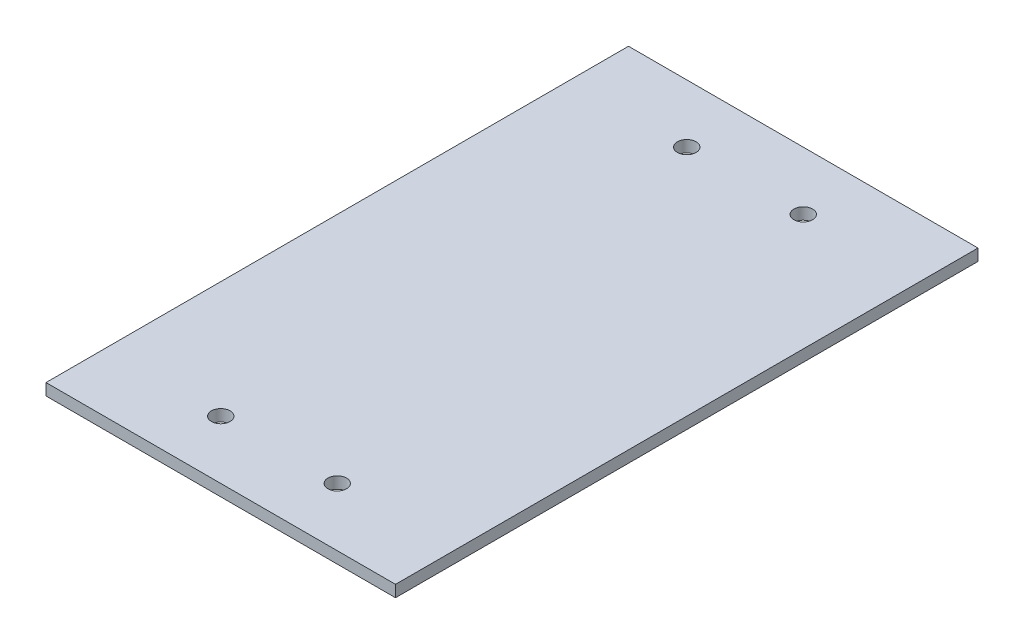
from build123d import *

# Parameters (mm, degrees)
SKETCH_1_W          = 60
SKETCH_1_H          = 100
EXTRUDE_1_DEPTH     = 2
CUT_EXTRUDE_1_REACH = 60.344
SKETCH_2_R          = 1.6


with BuildPart() as part:
    # 草图1 → 凸台-拉伸1 (new body)
    with BuildSketch(Plane(origin=(0, 0, 0), x_dir=(1, 0, 0), z_dir=(0, 1, 0))):
        Rectangle(SKETCH_1_W, SKETCH_1_H)
    extrude(amount=EXTRUDE_1_DEPTH)

    # 草图2 → 切除-拉伸1 (cut, up to next)
    with BuildSketch(Plane(origin=(0, 2, 0), x_dir=(1, 0, 0), z_dir=(0, 1, 0)), mode=Mode.PRIVATE) as cut_extrude_1_sk1:
        with Locations(Location((-10, 40, 0), (0, 0, 270))):
            Circle(SKETCH_2_R)
    cut_extrude_1_tool1 = extrude(cut_extrude_1_sk1.sketch, amount=-CUT_EXTRUDE_1_REACH, mode=Mode.PRIVATE) & part.part
    # 草图2 → 切除-拉伸1 (cut, up to next)
    with BuildSketch(Plane(origin=(0, 2, 0), x_dir=(1, 0, 0), z_dir=(0, 1, 0)), mode=Mode.PRIVATE) as cut_extrude_1_sk2:
        with Locations(Location((-10, -40, 0), (0, 0, 90))):
            Circle(SKETCH_2_R)
    cut_extrude_1_tool2 = extrude(cut_extrude_1_sk2.sketch, amount=-CUT_EXTRUDE_1_REACH, mode=Mode.PRIVATE) & part.part
    # 草图2 → 切除-拉伸1 (cut, up to next)
    with BuildSketch(Plane(origin=(0, 2, 0), x_dir=(1, 0, 0), z_dir=(0, 1, 0)), mode=Mode.PRIVATE) as cut_extrude_1_sk3:
        with Locations(Location((10, -40, 0), (0, 0, 270))):
            Circle(SKETCH_2_R)
    cut_extrude_1_tool3 = extrude(cut_extrude_1_sk3.sketch, amount=-CUT_EXTRUDE_1_REACH, mode=Mode.PRIVATE) & part.part
    # 草图2 → 切除-拉伸1 (cut, up to next)
    with BuildSketch(Plane(origin=(0, 2, 0), x_dir=(1, 0, 0), z_dir=(0, 1, 0)), mode=Mode.PRIVATE) as cut_extrude_1_sk4:
        with Locations(Location((10, 40, 0), (0, 0, 90))):
            Circle(SKETCH_2_R)
    cut_extrude_1_tool4 = extrude(cut_extrude_1_sk4.sketch, amount=-CUT_EXTRUDE_1_REACH, mode=Mode.PRIVATE) & part.part
    add(cut_extrude_1_tool1.solids().sort_by_distance((-10, 2, -40))[0], mode=Mode.SUBTRACT)
    add(cut_extrude_1_tool2.solids().sort_by_distance((-10, 2, 40))[0], mode=Mode.SUBTRACT)
    add(cut_extrude_1_tool3.solids().sort_by_distance((10, 2, 40))[0], mode=Mode.SUBTRACT)
    add(cut_extrude_1_tool4.solids().sort_by_distance((10, 2, -40))[0], mode=Mode.SUBTRACT)


solid = part.part
